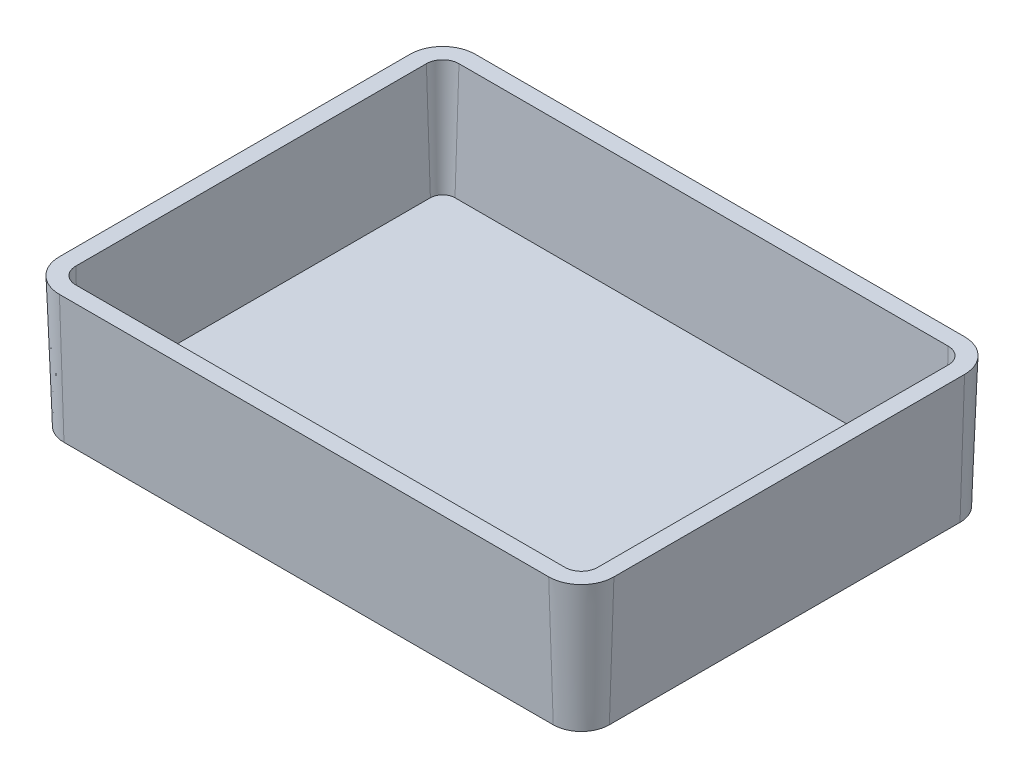
from build123d import *

# Parameters (mm, degrees)
BOSS_EXTRUDE1_DEPTH = 4
BOSS_EXTRUDE1_DRAFT = -2
SHELL1_T            = -0.5


with BuildPart() as part:
    # Sketch1 → Boss-Extrude1 (with draft: the straight prism first)
    with BuildSketch(Plane(origin=(0, 0, 0), x_dir=(1, 0, 0), z_dir=(0, 1, 0))):
        with BuildLine():
            Line((-7.5, -6.375), (7.5, -6.375))
            ThreePointArc((7.5, -6.375), (8.207106781, -6.082106781), (8.5, -5.375))
            Line((8.5, -5.375), (8.5, 5.375))
            ThreePointArc((8.5, 5.375), (8.207106781, 6.082106781), (7.5, 6.375))
            Line((7.5, 6.375), (-7.5, 6.375))
            ThreePointArc((-7.5, 6.375), (-8.207106781, 6.082106781), (-8.5, 5.375))
            Line((-8.5, 5.375), (-8.5, -5.375))
            ThreePointArc((-8.5, -5.375), (-8.207106781, -6.082106781), (-7.5, -6.375))
        make_face()
    extrude(amount=-BOSS_EXTRUDE1_DEPTH)
    # Boss-Extrude1: the draft: its side faces are tilted about the plane it starts from
    boss_extrude1_sides = [part.faces().sort_by_distance(p)[0] for p in [
        (0, -2, 6.375),
        (8.207106781, -2, 6.082106781),
        (8.5, -2, 0),
        (8.207106781, -2, -6.082106781),
        (0, -2, -6.375),
        (-8.207106781, -2, -6.082106781),
        (-8.5, -2, 0),
        (-8.207106781, -2, 6.082106781),
    ]]
    draft(boss_extrude1_sides, Plane(origin=(0, 0, 0), x_dir=(1, 0, 0), z_dir=(0, 1, 0)), BOSS_EXTRUDE1_DRAFT)

    # Shell1
    shell1_openings = [part.faces().sort_by_distance(p)[0] for p in [
        (0, 0, 0),
    ]]
    offset(amount=SHELL1_T, openings=shell1_openings, kind=Kind.INTERSECTION)


solid = part.part
